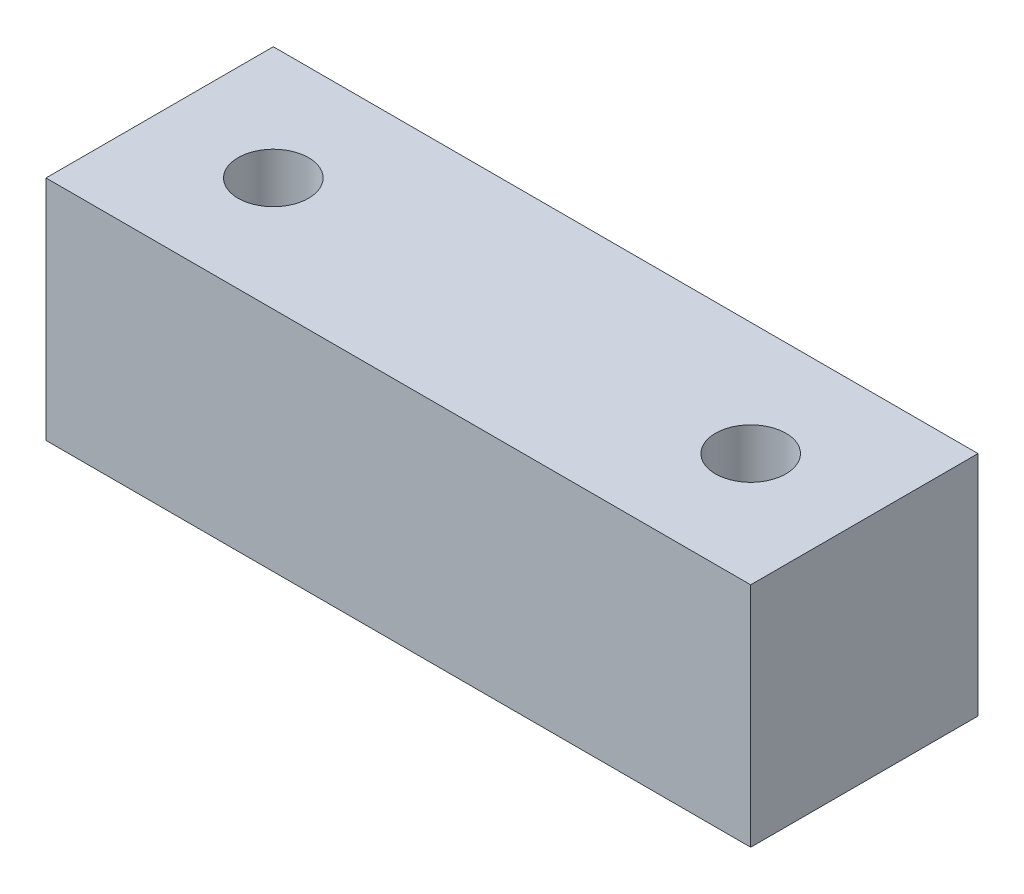
from build123d import *

# Parameters (mm, degrees)
SKETCH_1_W          = 31
SKETCH_1_H          = 10
EXTRUDE_1_DEPTH     = 10
SKETCH_2_R          = 1.55
CUT_EXTRUDE_1_DEPTH = 20.111514854


with BuildPart() as part:
    # ｽｹｯﾁ1 → ﾎﾞｽ - 押し出し1 (new body)
    with BuildSketch(Plane(origin=(0, 0, 0), x_dir=(1, 0, 0), z_dir=(0, 1, 0))):
        Rectangle(SKETCH_1_W, SKETCH_1_H)
    extrude(amount=EXTRUDE_1_DEPTH)

    # ｽｹｯﾁ2 → ｶｯﾄ - 押し出し1 (cut, through all)
    with BuildSketch(Plane(origin=(0, 10, 0), x_dir=(1, 0, 0), z_dir=(0, 1, 0))):
        with Locations(Location((-10.5, 0, 0), (0, 0, 270))):
            Circle(SKETCH_2_R)
        with Locations(Location((10.5, 0, 0), (0, 0, 270))):
            Circle(SKETCH_2_R)
    extrude(amount=-CUT_EXTRUDE_1_DEPTH, mode=Mode.SUBTRACT)


solid = part.part
